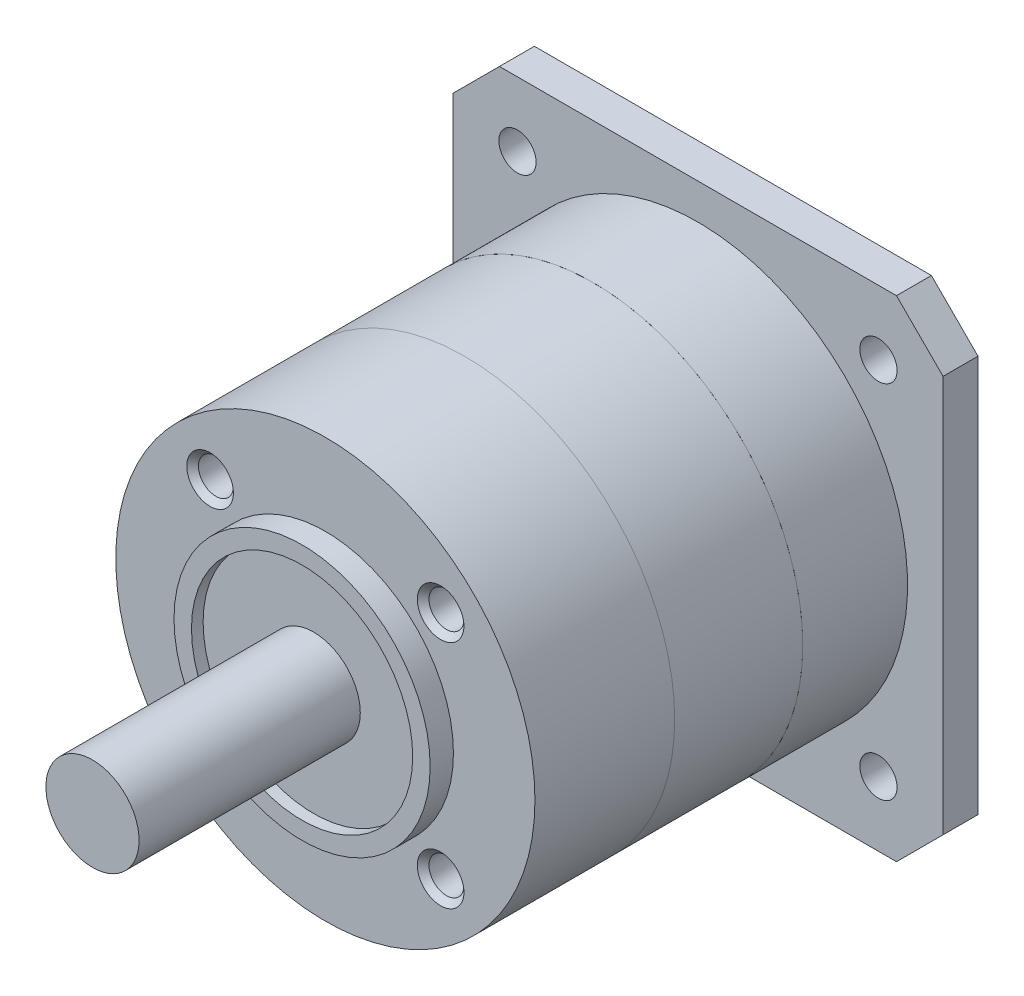
from build123d import *

# Parameters (mm, degrees)
SKETCH1_W           = 42.1
SKETCH1_H           = 42.1
BOSS_EXTRUDE2_DEPTH = 3
SKETCH3_R           = 18
BOSS_EXTRUDE3_DEPTH = 9
SKETCH4_R           = 18
BOSS_EXTRUDE4_DEPTH = 11
SKETCH5_R           = 18
BOSS_EXTRUDE5_DEPTH = 12
SKETCH6_R           = 11
BOSS_EXTRUDE6_DEPTH = 2
SKETCH9_R           = 9.5
CUT_EXTRUDE2_DEPTH  = 1
SKETCH7_R           = 4
BOSS_EXTRUDE7_DEPTH = 20
SKETCH10_R          = 1.6
CUT_EXTRUDE3_DEPTH  = 3
SKETCH12_R          = 1.5
CUT_EXTRUDE5_DEPTH  = 10
CHAMFER1_SIZE       = 4
CHAMFER2_SIZE       = 0.5
SKETCH15_R          = 11
CUT_EXTRUDE8_DEPTH  = 1.5


with BuildPart() as part:
    # Sketch1 → Boss-Extrude2 (new body)
    with BuildSketch(Plane.XY):
        Rectangle(SKETCH1_W, SKETCH1_H)
    extrude(amount=BOSS_EXTRUDE2_DEPTH)

    # Sketch3 → Boss-Extrude3 (add)
    with BuildSketch(Plane.XY.offset(3)):
        with Locations(Location((0, 0, 0), (0, 0, 180))):
            Circle(SKETCH3_R)
    extrude(amount=BOSS_EXTRUDE3_DEPTH)

    # Sketch10 → Cut-Extrude3 (cut)
    with BuildSketch(Plane(origin=(0, 0, 0), x_dir=(-1, 0, 0), z_dir=(0, 0, -1))):
        with Locations((-15.5, 15.5)):
            Circle(SKETCH10_R)
        with Locations((15.5, 15.5)):
            Circle(SKETCH10_R)
        with Locations((15.5, -15.5)):
            Circle(SKETCH10_R)
        with Locations((-15.5, -15.5)):
            Circle(SKETCH10_R)
    extrude(amount=-CUT_EXTRUDE3_DEPTH, mode=Mode.SUBTRACT)

    # Chamfer1
    chamfer1_edges = [part.edges().sort_by_distance(p)[0] for p in [
        (-21.05, 21.05, 1.5),
        (21.05, 21.05, 1.5),
        (21.05, -21.05, 1.5),
        (-21.05, -21.05, 1.5),
    ]]
    chamfer(chamfer1_edges, length=CHAMFER1_SIZE)

    # Sketch15 → Cut-Extrude8 (cut)
    with BuildSketch(Plane(origin=(0, 0, 0), x_dir=(-1, 0, 0), z_dir=(0, 0, -1))):
        with Locations(Location((0, 0, 0), (0, 0, 180))):
            Circle(SKETCH15_R)
    extrude(amount=-CUT_EXTRUDE8_DEPTH, mode=Mode.SUBTRACT)


with BuildPart() as body_2:
    # Sketch4 → Boss-Extrude4 (new body)
    with BuildSketch(Plane.XY.offset(12)):
        Circle(SKETCH4_R)
    extrude(amount=BOSS_EXTRUDE4_DEPTH)


with BuildPart() as body_3:
    # Sketch5 → Boss-Extrude5 (new body)
    with BuildSketch(Plane.XY.offset(23)):
        Circle(SKETCH5_R)
    extrude(amount=BOSS_EXTRUDE5_DEPTH)

    # Sketch6 → Boss-Extrude6 (add)
    with BuildSketch(Plane.XY.offset(35)):
        Circle(SKETCH6_R)
    extrude(amount=BOSS_EXTRUDE6_DEPTH)

    # Sketch9 → Cut-Extrude2 (cut)
    with BuildSketch(Plane.XY.offset(37)):
        Circle(SKETCH9_R)
    extrude(amount=-CUT_EXTRUDE2_DEPTH, mode=Mode.SUBTRACT)

    # Sketch12 → Cut-Extrude5 (cut)
    with BuildSketch(Plane.XY.offset(35)):
        with Locations((-9.899494937, 9.899494937)):
            Circle(SKETCH12_R)
        with Locations((9.899494937, 9.899494937)):
            Circle(SKETCH12_R)
        with Locations((9.899494937, -9.899494937)):
            Circle(SKETCH12_R)
        with Locations((-9.899494937, -9.899494937)):
            Circle(SKETCH12_R)
    extrude(amount=-CUT_EXTRUDE5_DEPTH, mode=Mode.SUBTRACT)

    # Chamfer2
    chamfer2_edges = [body_3.edges().sort_by_distance(p)[0] for p in [
        (-11.399494937, -9.899494937, 35),
        (8.399494937, -9.899494937, 35),
        (8.399494937, 9.899494937, 35),
        (-11.399494937, 9.899494937, 35),
    ]]
    chamfer(chamfer2_edges, length=CHAMFER2_SIZE)


with BuildPart() as body_4:
    # Sketch7 → Boss-Extrude7 (new body)
    with BuildSketch(Plane.XY.offset(35)):
        Circle(SKETCH7_R)
    extrude(amount=BOSS_EXTRUDE7_DEPTH)


solid = Compound([part.part, body_2.part, body_3.part, body_4.part])
